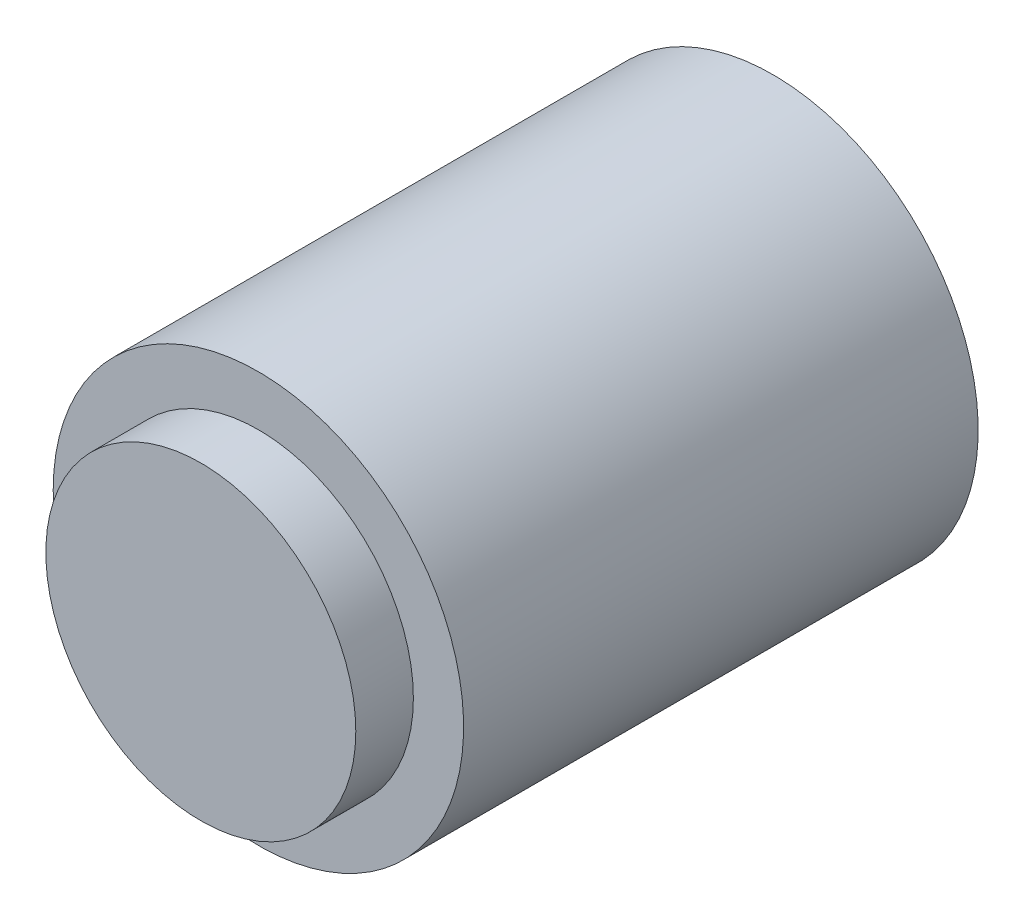
from build123d import *

# Parameters (mm, degrees)
SKETCH1_R           = 16.75
BOSS_EXTRUDE1_DEPTH = 42
SKETCH2_R           = 12.65
BOSS_EXTRUDE2_DEPTH = 4.7
SKETCH3_R           = 15.5
CUT_EXTRUDE1_DEPTH  = 4.7


with BuildPart() as part:
    # Sketch1 → Boss-Extrude1 (new body)
    with BuildSketch(Plane.XY):
        with Locations(Location((0, 0, 0), (0, 0, 180))):
            Circle(SKETCH1_R)
    extrude(amount=BOSS_EXTRUDE1_DEPTH)

    # Sketch2 → Boss-Extrude2 (add)
    with BuildSketch(Plane.XY.offset(42)):
        Circle(SKETCH2_R)
    extrude(amount=BOSS_EXTRUDE2_DEPTH)

    # Sketch3 → Cut-Extrude1 (cut)
    with BuildSketch(Plane(origin=(0, 0, 0), x_dir=(-1, 0, 0), z_dir=(0, 0, -1))):
        Circle(SKETCH3_R)
    extrude(amount=-CUT_EXTRUDE1_DEPTH, mode=Mode.SUBTRACT)


solid = part.part
